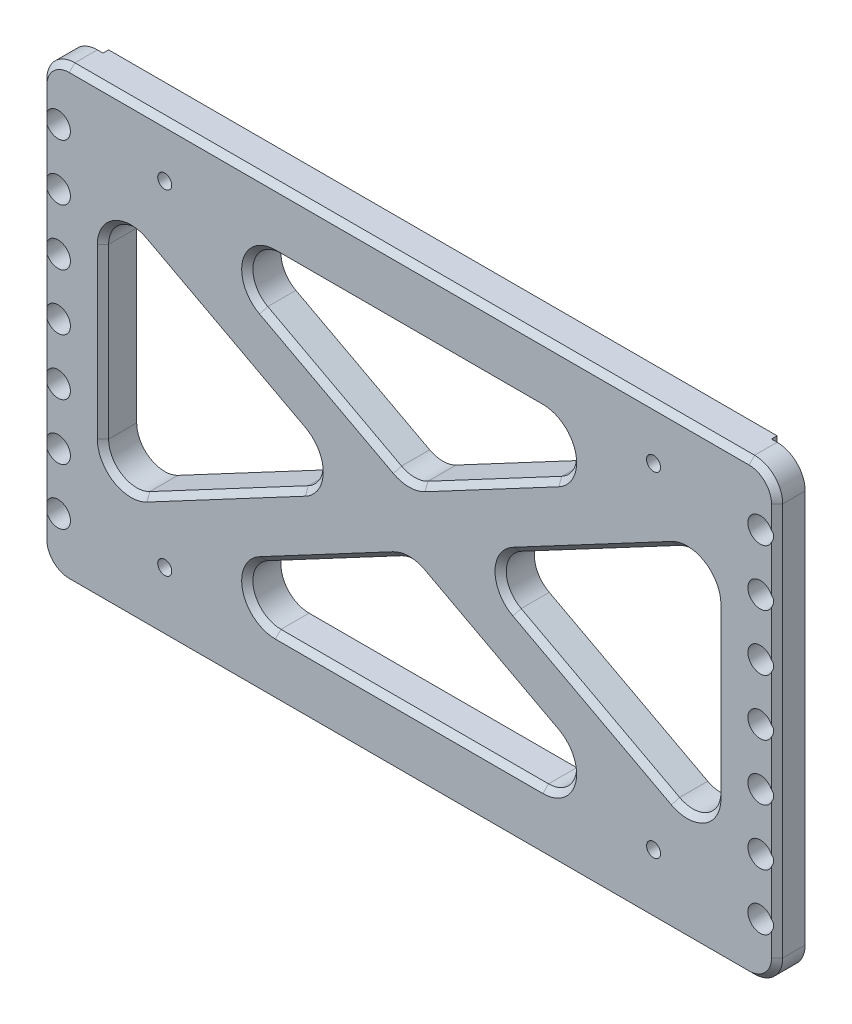
from build123d import *

# Parameters (mm, degrees)
SKETCH_3_W             = 131
SKETCH_3_H             = 80
EXTRUDE_3_DEPTH        = 5
SKETCH_4_W             = 119
SKETCH_4_H             = 80
EXTRUDE_4_DEPTH        = 6
FILLET_2_R             = 5
CHAMFER_1_SIZE         = 1
CUT_EXTRUDE_1_DEPTH    = 6
FILLET_3_R             = 5
CHAMFER_2_SIZE         = 1
SKETCH_6_R             = 2.2
CUT_EXTRUDE_2_DEPTH    = 11
HOLE_WIZARD_M3_1_D     = 2.5
HOLE_WIZARD_M3_1_DEPTH = 7.5
HOLE_WIZARD_M3_1_TIP   = 0.751075774


with BuildPart() as part:
    # 草图3 → 凸台-拉伸3 (new body)
    with BuildSketch(Plane.XY):
        with Locations((0, -51.5)):
            Rectangle(SKETCH_3_W, SKETCH_3_H)
    extrude(amount=EXTRUDE_3_DEPTH)

    # 草图4 → 凸台-拉伸4 (add)
    with BuildSketch(Plane.XY.offset(5)):
        with Locations((0, -51.5)):
            Rectangle(SKETCH_4_W, SKETCH_4_H)
    extrude(amount=-EXTRUDE_4_DEPTH)

    # 圆角2
    fillet_2_edges = [part.edges().sort_by_distance(p)[0] for p in [
        (-65.5, -11.5, 2.5),
        (65.5, -11.5, 2.5),
        (65.5, -91.5, 2.5),
        (-65.5, -91.5, 2.5),
    ]]
    fillet(fillet_2_edges, radius=FILLET_2_R)

    # 倒角1
    chamfer_1_edges = [part.edges().sort_by_distance(p)[0] for p in [
        (0, -11.5, 5),
        (65.5, -51.5, 5),
        (0, -91.5, 5),
        (-65.5, -51.5, 5),
        (64.035533906, -90.035533906, 5),
        (-64.035533906, -90.035533906, 5),
        (-64.035533906, -12.964466094, 5),
        (64.035533906, -12.964466094, 5),
    ]]
    chamfer(chamfer_1_edges, length=CHAMFER_1_SIZE)

    # 草图5 → 切除-拉伸1 (cut)
    with BuildSketch(Plane.XY.offset(5)):
        Polygon((-10.644021059, -51.5), (-54.5, -28.163791023), (-54.5, -74.836208978), align=None)
        Polygon((43.855978941, -22.5), (-43.855978941, -22.5), (0, -45.836208978), align=None)
        Polygon((54.5, -28.163791023), (10.644021059, -51.5), (54.5, -74.836208978), align=None)
        Polygon((43.855978941, -80.5), (0, -57.163791023), (-43.855978941, -80.5), align=None)
    extrude(amount=-CUT_EXTRUDE_1_DEPTH, mode=Mode.SUBTRACT)

    # 圆角3
    fillet_3_edges = [part.edges().sort_by_distance(p)[0] for p in [
        (10.644021059, -51.5, 2),
        (54.5, -28.163791023, 2),
        (54.5, -74.836208978, 2),
        (-43.855978941, -22.5, 2),
        (43.855978941, -22.5, 2),
        (0, -45.836208978, 2),
        (-43.855978941, -80.5, 2),
        (0, -57.163791023, 2),
        (43.855978941, -80.5, 2),
        (-54.5, -74.836208978, 2),
        (-54.5, -28.163791023, 2),
        (-10.644021059, -51.5, 2),
    ]]
    fillet(fillet_3_edges, radius=FILLET_3_R)

    # 倒角2
    chamfer_2_edges = [part.edges().sort_by_distance(p)[0] for p in [
        (33.045284631, -39.580061586, 5),
        (54.5, -51.5, 5),
        (33.045284631, -63.419938415, 5),
        (14.256439507, -38.250213644, 5),
        (-14.256439507, -38.250213644, 5),
        (0, -22.5, 5),
        (-33.045284631, -39.580061586, 5),
        (-33.045284631, -63.419938415, 5),
        (-54.5, -51.5, 5),
        (-14.256439507, -64.749786356, 5),
        (14.256439507, -64.749786356, 5),
        (0, -80.5, 5),
        (52.074521107, -32.201893935, 5),
        (52.074521107, -70.798106066, 5),
        (16.288042118, -51.5, 5),
        (0, -45.172417956, 5),
        (-28.666695849, -26.289632976, 5),
        (28.666695849, -26.289632976, 5),
        (-16.288042118, -51.5, 5),
        (-52.074521107, -70.798106066, 5),
        (-52.074521107, -32.201893935, 5),
        (0, -57.827582045, 5),
        (28.666695849, -76.710367025, 5),
        (-28.666695849, -76.710367025, 5),
    ]]
    chamfer(chamfer_2_edges, length=CHAMFER_2_SIZE)

    # 草图6 → 切除-拉伸2 (cut)
    with BuildSketch(Plane.XY.offset(5)):
        with Locations(Location((62.5, -21.5, 0), (0, 0, 24.619977329))):
            Circle(SKETCH_6_R)
        with Locations(Location((62.5, -31.5, 0), (0, 0, 24.619977329))):
            Circle(SKETCH_6_R)
        with Locations(Location((62.5, -41.5, 0), (0, 0, 24.619977329))):
            Circle(SKETCH_6_R)
        with Locations(Location((62.5, -51.5, 0), (0, 0, 24.619977329))):
            Circle(SKETCH_6_R)
        with Locations(Location((62.5, -61.5, 0), (0, 0, 24.619977329))):
            Circle(SKETCH_6_R)
        with Locations(Location((62.5, -71.5, 0), (0, 0, 24.619977329))):
            Circle(SKETCH_6_R)
        with Locations(Location((62.5, -81.5, 0), (0, 0, 335.380022671))):
            Circle(SKETCH_6_R)
    cut_extrude_2 = extrude(amount=-CUT_EXTRUDE_2_DEPTH, mode=Mode.SUBTRACT)

    # 镜向1: 切除-拉伸2 across plane
    add(cut_extrude_2.mirror(Plane(origin=(0, 0, 0), x_dir=(0, 0, 1), z_dir=(1, 0, 0))), mode=Mode.SUBTRACT)

    # M3 螺纹孔1
    with Locations(Plane.XY.offset(5)):
        with Locations((-43.51, -20.75), (43.51, -20.75), (43.51, -80.29), (-43.51, -80.29)):
            Hole(HOLE_WIZARD_M3_1_D / 2, depth=HOLE_WIZARD_M3_1_DEPTH)
            with Locations((0, 0, -(HOLE_WIZARD_M3_1_DEPTH + HOLE_WIZARD_M3_1_TIP / 2))):  # 118° drill point
                Cone(0, HOLE_WIZARD_M3_1_D / 2, HOLE_WIZARD_M3_1_TIP, mode=Mode.SUBTRACT)


solid = part.part
